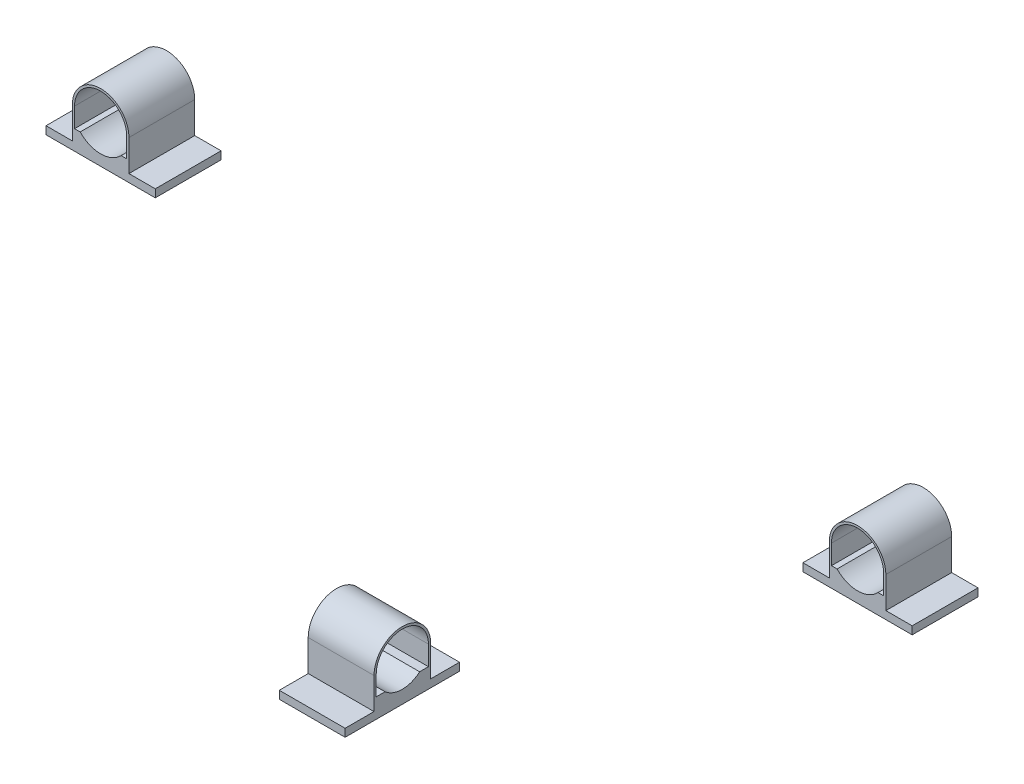
from build123d import *

# Parameters (mm, degrees)
EXTRUDE1_DEPTH   = 76.2
EXTRUDE1_2_DEPTH = 76.2
EXTRUDE2_DEPTH   = 38.1


with BuildPart() as part:
    # Sketch3 → Extrude1 (new body)
    with BuildSketch(Plane.XY):
        with BuildLine():
            Line((32.767111669, -22.622779043), (63.258683422, -22.622779043))
            Line((63.258683422, -22.622779043), (63.258683422, -13.524487472))
            Line((63.258683422, -13.524487472), (32.767111669, -13.524487472))
            Line((32.767111669, -13.524487472), (32.767111669, 22.622779043))
            ThreePointArc((32.767111669, 22.622779043), (0, 55.389890712), (-32.767111669, 22.622779043))
            Line((-32.767111669, 22.622779043), (-32.767111669, -13.524487472))
            Line((-32.767111669, -13.524487472), (-63.258683422, -13.524487472))
            Line((-63.258683422, -13.524487472), (-63.258683422, -22.622779043))
            Line((-63.258683422, -22.622779043), (-32.767111669, -22.622779043))
            Line((-32.767111669, -22.622779043), (32.767111669, -22.622779043))
        make_face()
        with BuildLine():
            Line((-30.227111669, 0), (-23.704292342, 0))
            ThreePointArc((-23.704292342, 0), (0, -10.144332625), (23.704292342, 0))
            Line((23.704292342, 0), (30.227111669, 0))
            Line((30.227111669, 0), (30.227111669, 22.622779043))
            ThreePointArc((30.227111669, 22.622779043), (0, 52.849890712), (-30.227111669, 22.622779043))
            Line((-30.227111669, 22.622779043), (-30.227111669, 0))
        make_face(mode=Mode.SUBTRACT)
    extrude(amount=EXTRUDE1_DEPTH)


with BuildPart() as body_2:
    # Sketch3 → Extrude1 2 (new body)
    with BuildSketch(Plane.XY):
        with BuildLine():
            Line((-909.169911587, -22.622779043), (-939.661483341, -22.622779043))
            Line((-939.661483341, -22.622779043), (-939.661483341, -13.524487472))
            Line((-939.661483341, -13.524487472), (-909.169911587, -13.524487472))
            Line((-909.169911587, -13.524487472), (-909.169911587, 22.622779043))
            ThreePointArc((-909.169911587, 22.622779043), (-876.402799918, 55.389890712), (-843.63568825, 22.622779043))
            Line((-843.63568825, 22.622779043), (-843.63568825, -13.524487472))
            Line((-843.63568825, -13.524487472), (-813.144116496, -13.524487472))
            Line((-813.144116496, -13.524487472), (-813.144116496, -22.622779043))
            Line((-813.144116496, -22.622779043), (-843.63568825, -22.622779043))
            Line((-843.63568825, -22.622779043), (-909.169911587, -22.622779043))
        make_face()
        with BuildLine():
            Line((-852.698507576, 0), (-846.17568825, 0))
            Line((-846.17568825, 0), (-846.17568825, 22.622779043))
            ThreePointArc((-846.17568825, 22.622779043), (-876.402799918, 52.849890712), (-906.629911587, 22.622779043))
            Line((-906.629911587, 22.622779043), (-906.629911587, 0))
            Line((-906.629911587, 0), (-900.107092261, 0))
            ThreePointArc((-900.107092261, 0), (-876.402799918, -10.144332625), (-852.698507576, 0))
        make_face(mode=Mode.SUBTRACT)
    extrude(amount=EXTRUDE1_2_DEPTH)


with BuildPart() as body_3:
    # Sketch4 → Extrude2 (new, symmetric)
    with BuildSketch(Plane.ZY.offset(438.201399959)):
        with BuildLine():
            Line((235.966, -215.173168973), (235.966, -237.804568973))
            Line((235.966, -237.804568973), (235.966, -251.317368973))
            Line((235.966, -251.317368973), (269.437597768, -251.317368973))
            Line((269.437597768, -251.317368973), (269.437597768, -260.410568973))
            Line((269.437597768, -260.410568973), (136.962402232, -260.410568973))
            Line((136.962402232, -260.410568973), (136.962402232, -251.317368973))
            Line((136.962402232, -251.317368973), (170.434, -251.317368973))
            Line((170.434, -251.317368973), (170.434, -237.804568973))
            Line((170.434, -237.804568973), (170.434, -215.173168973))
            ThreePointArc((170.434, -215.173168973), (203.2, -182.407168973), (235.966, -215.173168973))
        make_face()
        with BuildLine():
            ThreePointArc((183.16426168, -237.804568973), (203.2, -245.399168973), (223.23573832, -237.804568973))
            Line((223.23573832, -237.804568973), (233.426, -237.804568973))
            Line((233.426, -237.804568973), (233.426, -215.173168973))
            ThreePointArc((233.426, -215.173168973), (203.2, -184.947168973), (172.974, -215.173168973))
            Line((172.974, -215.173168973), (172.974, -237.804568973))
            Line((172.974, -237.804568973), (183.16426168, -237.804568973))
        make_face(mode=Mode.SUBTRACT)
    extrude(amount=EXTRUDE2_DEPTH, both=True)


solid = Compound([part.part, body_2.part, body_3.part])
